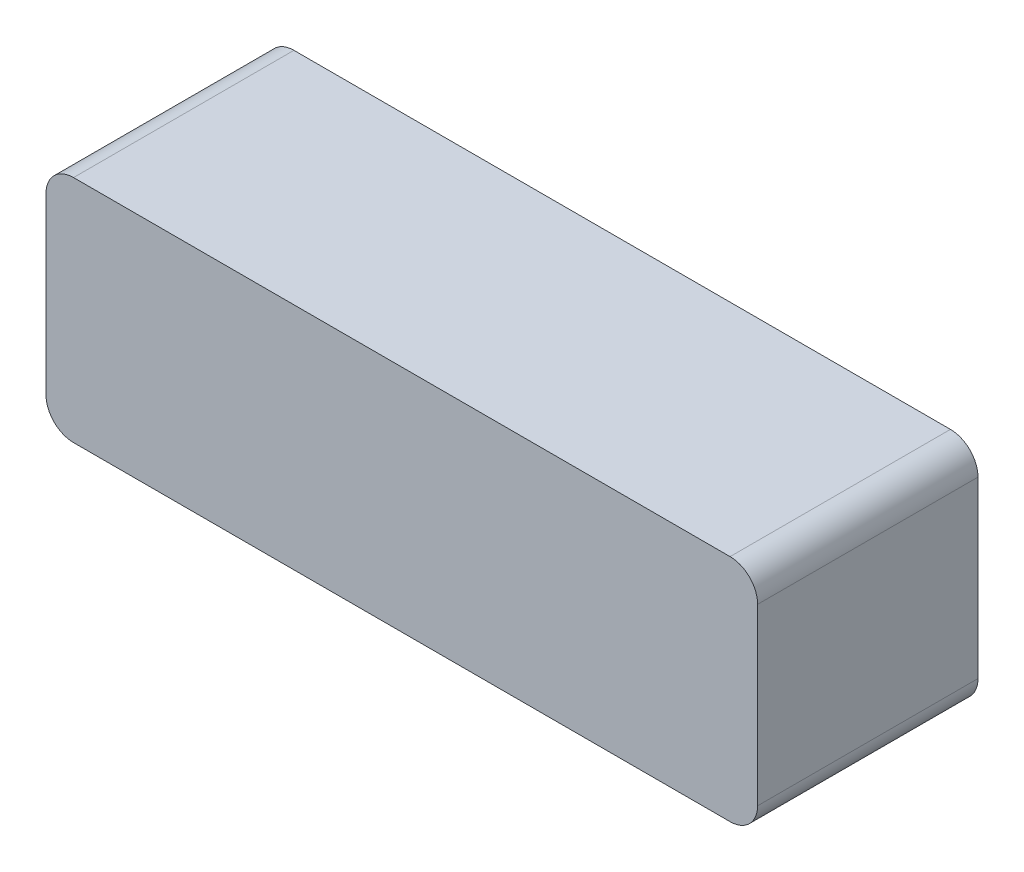
from build123d import *

# Parameters (mm, degrees)
BOSS_EXTRUDE1_DEPTH = 24


with BuildPart() as part:
    # Sketch1 → Boss-Extrude1 (new, symmetric)
    with BuildSketch(Plane.XY):
        with BuildLine():
            Line((-71.5, -25), (71.5, -25))
            ThreePointArc((71.5, -25), (75.742640687, -23.242640687), (77.5, -19))
            Line((77.5, -19), (77.5, 19))
            ThreePointArc((77.5, 19), (75.742640687, 23.242640687), (71.5, 25))
            Line((71.5, 25), (-71.5, 25))
            ThreePointArc((-71.5, 25), (-75.742640687, 23.242640687), (-77.5, 19))
            Line((-77.5, 19), (-77.5, -19))
            ThreePointArc((-77.5, -19), (-75.742640687, -23.242640687), (-71.5, -25))
        make_face()
    extrude(amount=BOSS_EXTRUDE1_DEPTH, both=True)


solid = part.part
